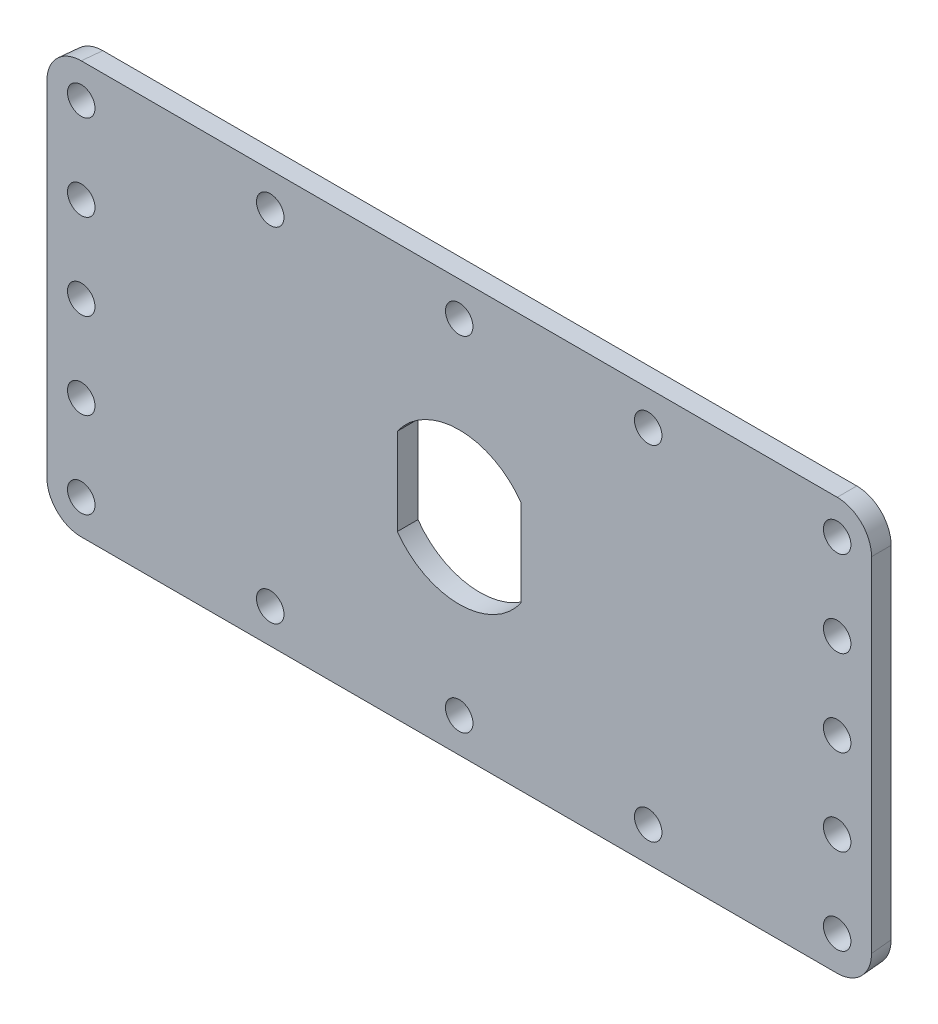
from build123d import *

# Parameters (mm, degrees)
SKETCH1_W           = 120
SKETCH1_H           = 60
BOSS_EXTRUDE1_DEPTH = 3
BOSS_EXTRUDE1_DRAFT = -2.862405226
CUT_EXTRUDE4_DEPTH  = 25
FILLET1_R           = 5
CUT_EXTRUDE5_REACH  = 69.149
SKETCH6_R           = 2


with BuildPart() as part:
    # Sketch1 → Boss-Extrude1 (with draft: the straight prism first)
    with BuildSketch(Plane.XY):
        Rectangle(SKETCH1_W, SKETCH1_H)
    extrude(amount=-BOSS_EXTRUDE1_DEPTH)
    # Boss-Extrude1: the draft: its side faces are tilted about the plane it starts from
    boss_extrude1_sides = [part.faces().sort_by_distance(p)[0] for p in [
        (0, -30, -1.5),
        (60, 0, -1.5),
        (0, 30, -1.5),
        (-60, 0, -1.5),
    ]]
    draft(boss_extrude1_sides, Plane.XY, BOSS_EXTRUDE1_DRAFT)

    # Sketch5 → Cut-Extrude4 (cut)
    with BuildSketch(Plane.XY):
        with BuildLine():
            Line((-9, 6.32455532), (-9, -6.32455532))
            ThreePointArc((-9, -6.32455532), (0, -11), (9, -6.32455532))
            Line((9, -6.32455532), (9, 6.32455532))
            ThreePointArc((9, 6.32455532), (0, 11), (-9, 6.32455532))
        make_face()
    extrude(amount=-CUT_EXTRUDE4_DEPTH, mode=Mode.SUBTRACT)

    # Fillet1
    fillet1_edges = [part.edges().sort_by_distance(p)[0] for p in [
        (59.925, -29.925, -1.5),
        (-59.925, -29.925, -1.5),
        (-59.925, 29.925, -1.5),
        (59.925, 29.925, -1.5),
    ]]
    fillet(fillet1_edges, radius=FILLET1_R)

    # Sketch6 → Cut-Extrude5 (cut, up to next)
    with BuildSketch(Plane.XY, mode=Mode.PRIVATE) as cut_extrude5_sk1:
        with Locations((-55, 25)):
            Circle(SKETCH6_R)
    cut_extrude5_tool1 = extrude(cut_extrude5_sk1.sketch, amount=-CUT_EXTRUDE5_REACH, mode=Mode.PRIVATE) & part.part
    # Sketch6 → Cut-Extrude5 (cut, up to next)
    with BuildSketch(Plane.XY, mode=Mode.PRIVATE) as cut_extrude5_sk2:
        with Locations((-27.5, 25)):
            Circle(SKETCH6_R)
    cut_extrude5_tool2 = extrude(cut_extrude5_sk2.sketch, amount=-CUT_EXTRUDE5_REACH, mode=Mode.PRIVATE) & part.part
    # Sketch6 → Cut-Extrude5 (cut, up to next)
    with BuildSketch(Plane.XY, mode=Mode.PRIVATE) as cut_extrude5_sk3:
        with Locations((0, 25)):
            Circle(SKETCH6_R)
    cut_extrude5_tool3 = extrude(cut_extrude5_sk3.sketch, amount=-CUT_EXTRUDE5_REACH, mode=Mode.PRIVATE) & part.part
    # Sketch6 → Cut-Extrude5 (cut, up to next)
    with BuildSketch(Plane.XY, mode=Mode.PRIVATE) as cut_extrude5_sk4:
        with Locations((27.5, 25)):
            Circle(SKETCH6_R)
    cut_extrude5_tool4 = extrude(cut_extrude5_sk4.sketch, amount=-CUT_EXTRUDE5_REACH, mode=Mode.PRIVATE) & part.part
    # Sketch6 → Cut-Extrude5 (cut, up to next)
    with BuildSketch(Plane.XY, mode=Mode.PRIVATE) as cut_extrude5_sk5:
        with Locations((55, 25)):
            Circle(SKETCH6_R)
    cut_extrude5_tool5 = extrude(cut_extrude5_sk5.sketch, amount=-CUT_EXTRUDE5_REACH, mode=Mode.PRIVATE) & part.part
    # Sketch6 → Cut-Extrude5 (cut, up to next)
    with BuildSketch(Plane.XY, mode=Mode.PRIVATE) as cut_extrude5_sk6:
        with Locations((55, -25)):
            Circle(SKETCH6_R)
    cut_extrude5_tool6 = extrude(cut_extrude5_sk6.sketch, amount=-CUT_EXTRUDE5_REACH, mode=Mode.PRIVATE) & part.part
    # Sketch6 → Cut-Extrude5 (cut, up to next)
    with BuildSketch(Plane.XY, mode=Mode.PRIVATE) as cut_extrude5_sk7:
        with Locations((27.5, -25)):
            Circle(SKETCH6_R)
    cut_extrude5_tool7 = extrude(cut_extrude5_sk7.sketch, amount=-CUT_EXTRUDE5_REACH, mode=Mode.PRIVATE) & part.part
    # Sketch6 → Cut-Extrude5 (cut, up to next)
    with BuildSketch(Plane.XY, mode=Mode.PRIVATE) as cut_extrude5_sk8:
        with Locations((0, -25)):
            Circle(SKETCH6_R)
    cut_extrude5_tool8 = extrude(cut_extrude5_sk8.sketch, amount=-CUT_EXTRUDE5_REACH, mode=Mode.PRIVATE) & part.part
    # Sketch6 → Cut-Extrude5 (cut, up to next)
    with BuildSketch(Plane.XY, mode=Mode.PRIVATE) as cut_extrude5_sk9:
        with Locations((-27.5, -25)):
            Circle(SKETCH6_R)
    cut_extrude5_tool9 = extrude(cut_extrude5_sk9.sketch, amount=-CUT_EXTRUDE5_REACH, mode=Mode.PRIVATE) & part.part
    # Sketch6 → Cut-Extrude5 (cut, up to next)
    with BuildSketch(Plane.XY, mode=Mode.PRIVATE) as cut_extrude5_sk10:
        with Locations((-55, -25)):
            Circle(SKETCH6_R)
    cut_extrude5_tool10 = extrude(cut_extrude5_sk10.sketch, amount=-CUT_EXTRUDE5_REACH, mode=Mode.PRIVATE) & part.part
    # Sketch6 → Cut-Extrude5 (cut, up to next)
    with BuildSketch(Plane.XY, mode=Mode.PRIVATE) as cut_extrude5_sk11:
        with Locations((-55, 12.5)):
            Circle(SKETCH6_R)
    cut_extrude5_tool11 = extrude(cut_extrude5_sk11.sketch, amount=-CUT_EXTRUDE5_REACH, mode=Mode.PRIVATE) & part.part
    # Sketch6 → Cut-Extrude5 (cut, up to next)
    with BuildSketch(Plane.XY, mode=Mode.PRIVATE) as cut_extrude5_sk12:
        with Locations((-55, 0)):
            Circle(SKETCH6_R)
    cut_extrude5_tool12 = extrude(cut_extrude5_sk12.sketch, amount=-CUT_EXTRUDE5_REACH, mode=Mode.PRIVATE) & part.part
    # Sketch6 → Cut-Extrude5 (cut, up to next)
    with BuildSketch(Plane.XY, mode=Mode.PRIVATE) as cut_extrude5_sk13:
        with Locations((-55, -12.5)):
            Circle(SKETCH6_R)
    cut_extrude5_tool13 = extrude(cut_extrude5_sk13.sketch, amount=-CUT_EXTRUDE5_REACH, mode=Mode.PRIVATE) & part.part
    # Sketch6 → Cut-Extrude5 (cut, up to next)
    with BuildSketch(Plane.XY, mode=Mode.PRIVATE) as cut_extrude5_sk14:
        with Locations((55, -12.5)):
            Circle(SKETCH6_R)
    cut_extrude5_tool14 = extrude(cut_extrude5_sk14.sketch, amount=-CUT_EXTRUDE5_REACH, mode=Mode.PRIVATE) & part.part
    # Sketch6 → Cut-Extrude5 (cut, up to next)
    with BuildSketch(Plane.XY, mode=Mode.PRIVATE) as cut_extrude5_sk15:
        with Locations((55, 0)):
            Circle(SKETCH6_R)
    cut_extrude5_tool15 = extrude(cut_extrude5_sk15.sketch, amount=-CUT_EXTRUDE5_REACH, mode=Mode.PRIVATE) & part.part
    # Sketch6 → Cut-Extrude5 (cut, up to next)
    with BuildSketch(Plane.XY, mode=Mode.PRIVATE) as cut_extrude5_sk16:
        with Locations((55, 12.5)):
            Circle(SKETCH6_R)
    cut_extrude5_tool16 = extrude(cut_extrude5_sk16.sketch, amount=-CUT_EXTRUDE5_REACH, mode=Mode.PRIVATE) & part.part
    add(cut_extrude5_tool1.solids().sort_by_distance((-55, 25, 0))[0], mode=Mode.SUBTRACT)
    add(cut_extrude5_tool2.solids().sort_by_distance((-27.5, 25, 0))[0], mode=Mode.SUBTRACT)
    add(cut_extrude5_tool3.solids().sort_by_distance((0, 25, 0))[0], mode=Mode.SUBTRACT)
    add(cut_extrude5_tool4.solids().sort_by_distance((27.5, 25, 0))[0], mode=Mode.SUBTRACT)
    add(cut_extrude5_tool5.solids().sort_by_distance((55, 25, 0))[0], mode=Mode.SUBTRACT)
    add(cut_extrude5_tool6.solids().sort_by_distance((55, -25, 0))[0], mode=Mode.SUBTRACT)
    add(cut_extrude5_tool7.solids().sort_by_distance((27.5, -25, 0))[0], mode=Mode.SUBTRACT)
    add(cut_extrude5_tool8.solids().sort_by_distance((0, -25, 0))[0], mode=Mode.SUBTRACT)
    add(cut_extrude5_tool9.solids().sort_by_distance((-27.5, -25, 0))[0], mode=Mode.SUBTRACT)
    add(cut_extrude5_tool10.solids().sort_by_distance((-55, -25, 0))[0], mode=Mode.SUBTRACT)
    add(cut_extrude5_tool11.solids().sort_by_distance((-55, 12.5, 0))[0], mode=Mode.SUBTRACT)
    add(cut_extrude5_tool12.solids().sort_by_distance((-55, 0, 0))[0], mode=Mode.SUBTRACT)
    add(cut_extrude5_tool13.solids().sort_by_distance((-55, -12.5, 0))[0], mode=Mode.SUBTRACT)
    add(cut_extrude5_tool14.solids().sort_by_distance((55, -12.5, 0))[0], mode=Mode.SUBTRACT)
    add(cut_extrude5_tool15.solids().sort_by_distance((55, 0, 0))[0], mode=Mode.SUBTRACT)
    add(cut_extrude5_tool16.solids().sort_by_distance((55, 12.5, 0))[0], mode=Mode.SUBTRACT)


solid = part.part
